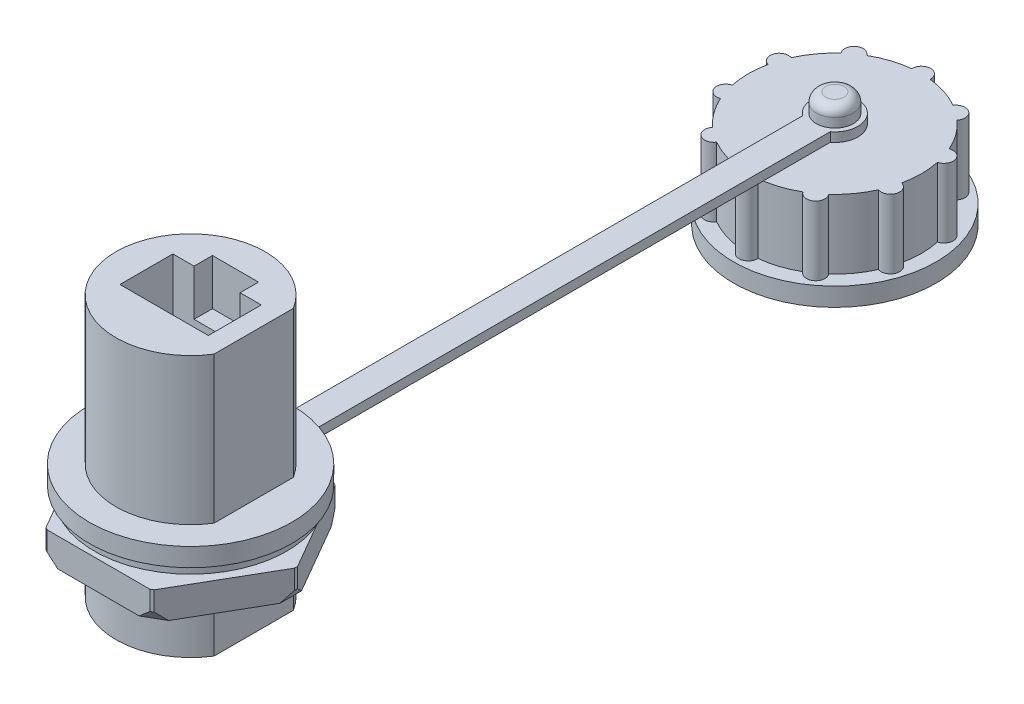
from build123d import *
from OCP.BRepFilletAPI import BRepFilletAPI_MakeChamfer

# Parameters (mm, degrees)
BOSS_EXTRUDE1_DEPTH  = 13.335
SKETCH2_R            = 13.97
BOSS_EXTRUDE2_DEPTH  = 2.54
BOSS_EXTRUDE3_DEPTH  = 36.068
BOSS_EXTRUDE4_START  = 6.477
SKETCH3_R            = 10.287
BOSS_EXTRUDE4_DEPTH  = 3.937
CHAMFER1_SIZE        = 0.254
CHAMFER1_EDGE_2_SIZE = 0.254
CHAMFER1_EDGE_3_SIZE = 0.254
CHAMFER1_EDGE_4_SIZE = 0.254
CHAMFER1_EDGE_5_SIZE = 0.254
CHAMFER1_EDGE_6_SIZE = 0.254
SKETCH4_W            = 12.192
SKETCH4_H            = 7.3025
CUT_EXTRUDE1_DEPTH   = 10.922
SKETCH5_W            = 6.35
SKETCH5_H            = 2.54
CUT_EXTRUDE2_DEPTH   = 6.35
SKETCH6_R            = 13.267076916
BOSS_EXTRUDE5_DEPTH  = 1.27
BOSS_EXTRUDE6_DEPTH  = 1.27
SKETCH8_R            = 2.54
BOSS_EXTRUDE7_DEPTH  = 2.54
FILLET1_R            = 1.27
SKETCH9_R            = 11.938
BOSS_EXTRUDE8_DEPTH  = 12.065
SKETCH10_R           = 13.97
BOSS_EXTRUDE9_DEPTH  = 2.54
SKETCH11_R           = 10.287
CUT_EXTRUDE3_DEPTH   = 6.223
SKETCH12_R           = 1.27
BOSS_EXTRUDE10_DEPTH = 9.525
CIRPATTERN1_COUNT    = 10
CHAMFER2_SIZE        = 1.27
CHAMFER2_SIZE2       = 0.733234842


with BuildPart() as part:
    # Sketch1 → Boss-Extrude1 (new body)
    with BuildSketch(Plane(origin=(0, 0, 0), x_dir=(1, 0, 0), z_dir=(0, 1, 0))):
        with BuildLine():
            Line((8.7122, -5.469912263), (8.7122, 5.469912263))
            ThreePointArc((8.7122, 5.469912263), (-10.287, 0), (8.7122, -5.469912263))
        make_face()
    extrude(amount=BOSS_EXTRUDE1_DEPTH)

    # Sketch2 → Boss-Extrude2 (add)
    with BuildSketch(Plane(origin=(0, 13.335, 0), x_dir=(1, 0, 0), z_dir=(0, 1, 0))):
        with Locations(Location((0, 0, 0), (0, 0, 270))):
            Circle(SKETCH2_R)
    extrude(amount=BOSS_EXTRUDE2_DEPTH)

    # Sketch1<2> → Boss-Extrude3 (add)
    with BuildSketch(Plane(origin=(0, 0, 0), x_dir=(1, 0, 0), z_dir=(0, 1, 0))):
        with BuildLine():
            Line((8.7122, -5.469912263), (8.7122, 5.469912263))
            ThreePointArc((8.7122, 5.469912263), (-10.287, 0), (8.7122, -5.469912263))
        make_face()
    extrude(amount=BOSS_EXTRUDE3_DEPTH)

    # Sketch3 → Boss-Extrude4 (add)
    with BuildSketch(Plane.XZ.offset(-13.335).offset(BOSS_EXTRUDE4_START)):
        Polygon((7.332348419, 12.7), (-7.332348419, 12.7), (-14.664696837, 0), (-7.332348419, -12.7), (7.332348419, -12.7), (14.664696837, 0), align=None)
        Circle(SKETCH3_R, mode=Mode.SUBTRACT)
    extrude(amount=-BOSS_EXTRUDE4_DEPTH)

    # Chamfer1
    chamfer1_edges = [part.edges().sort_by_distance(p)[0] for p in [
        (14.664696837, 8.8265, 0),
    ]]
    chamfer(chamfer1_edges, length=CHAMFER1_SIZE)

    # Chamfer1 edge 2
    chamfer1_edge_2_edges = [part.edges().sort_by_distance(p)[0] for p in [
        (7.332348419, 8.8265, 12.7),
    ]]
    chamfer(chamfer1_edge_2_edges, length=CHAMFER1_EDGE_2_SIZE)

    # Chamfer1 edge 3
    chamfer1_edge_3_edges = [part.edges().sort_by_distance(p)[0] for p in [
        (-7.332348419, 8.8265, 12.7),
    ]]
    chamfer(chamfer1_edge_3_edges, length=CHAMFER1_EDGE_3_SIZE)

    # Chamfer1 edge 4
    chamfer1_edge_4_edges = [part.edges().sort_by_distance(p)[0] for p in [
        (-14.664696837, 8.8265, 0),
    ]]
    chamfer(chamfer1_edge_4_edges, length=CHAMFER1_EDGE_4_SIZE)

    # Chamfer1 edge 5
    chamfer1_edge_5_edges = [part.edges().sort_by_distance(p)[0] for p in [
        (-7.332348419, 8.8265, -12.7),
    ]]
    chamfer(chamfer1_edge_5_edges, length=CHAMFER1_EDGE_5_SIZE)

    # Chamfer1 edge 6
    chamfer1_edge_6_edges = [part.edges().sort_by_distance(p)[0] for p in [
        (7.332348419, 8.8265, -12.7),
    ]]
    chamfer(chamfer1_edge_6_edges, length=CHAMFER1_EDGE_6_SIZE)

    # Sketch4 → Cut-Extrude1 (cut)
    with BuildSketch(Plane.XZ):
        Rectangle(SKETCH4_W, SKETCH4_H)
    cut_extrude1 = extrude(amount=-CUT_EXTRUDE1_DEPTH, mode=Mode.SUBTRACT)

    # Sketch5 → Cut-Extrude2 (cut)
    with BuildSketch(Plane.XZ):
        with Locations((0, -4.92125)):
            Rectangle(SKETCH5_W, SKETCH5_H)
    cut_extrude2 = extrude(amount=-CUT_EXTRUDE2_DEPTH, mode=Mode.SUBTRACT)

    # Mirror1: Cut-Extrude1, Cut-Extrude2 across plane
    add(cut_extrude1.mirror(Plane(origin=(0, 18.034, 0), x_dir=(0, 0, 1), z_dir=(0, -1, 0))), mode=Mode.SUBTRACT)
    add(cut_extrude2.mirror(Plane(origin=(0, 18.034, 0), x_dir=(0, 0, 1), z_dir=(0, -1, 0))), mode=Mode.SUBTRACT)

    # Sketch6 → Boss-Extrude5 (add)
    with BuildSketch(Plane.XZ.offset(-13.335)):
        with Locations(Location((0, 0, 0), (0, 0, 90))):
            Circle(SKETCH6_R)
    extrude(amount=BOSS_EXTRUDE5_DEPTH)

    # Sketch7 → Boss-Extrude6 (add)
    with BuildSketch(Plane.XZ.offset(-12.065)):
        with BuildLine():
            Line((-1.905, -10.109072361), (1.905, -10.109072361))
            Line((1.905, -10.109072361), (1.905, -86.309072361))
            ThreePointArc((1.905, -86.309072361), (0, -92.024072361), (-1.905, -86.309072361))
            Line((-1.905, -86.309072361), (-1.905, -10.109072361))
        make_face()
    extrude(amount=-BOSS_EXTRUDE6_DEPTH)

    # Sketch8 → Boss-Extrude7 (add)
    with BuildSketch(Plane(origin=(0, 13.335, 0), x_dir=(1, 0, 0), z_dir=(0, 1, 0))):
        with Locations(Location((0, 88.849072361, 0), (0, 0, 270))):
            Circle(SKETCH8_R)
    extrude(amount=BOSS_EXTRUDE7_DEPTH)

    # Fillet1
    fillet1_edges = [part.edges().sort_by_distance(p)[0] for p in [
        (0, 15.875, -91.389072361),
    ]]
    fillet(fillet1_edges, radius=FILLET1_R)

    # Sketch9 → Boss-Extrude8 (add)
    with BuildSketch(Plane.XZ.offset(-12.065)):
        with Locations(Location((0, -88.849072361, 0), (0, 0, 99.182197699))):
            Circle(SKETCH9_R)
    extrude(amount=BOSS_EXTRUDE8_DEPTH)

    # Sketch10 → Boss-Extrude9 (add)
    with BuildSketch(Plane.XZ):
        with Locations(Location((0, -88.849072361, 0), (0, 0, 270))):
            Circle(SKETCH10_R)
    extrude(amount=-BOSS_EXTRUDE9_DEPTH)

    # Sketch11 → Cut-Extrude3 (cut)
    with BuildSketch(Plane.XZ):
        with Locations(Location((0, -88.849072361, 0), (0, 0, 270))):
            Circle(SKETCH11_R)
    extrude(amount=-CUT_EXTRUDE3_DEPTH, mode=Mode.SUBTRACT)

    # Sketch12 → Boss-Extrude10 (add)
    with BuildSketch(Plane(origin=(0, 12.065, 0), x_dir=(1, 0, 0), z_dir=(0, 1, 0))):
        with Locations((0, 100.787072361)):
            Circle(SKETCH12_R)
    boss_extrude10 = extrude(amount=-BOSS_EXTRUDE10_DEPTH)

    # CirPattern1: Boss-Extrude10 ×10 about axis
    cirpattern1_axis = Axis((0, 0, -88.849072361), (0, 1, 0))
    for i in range(1, CIRPATTERN1_COUNT):
        add(boss_extrude10.rotate(cirpattern1_axis, i * 360 / CIRPATTERN1_COUNT))

    # Chamfer2: one chamfer whose edges measure the first distance from different faces: ONE call of the kernel's chamfer builder (chamfer() names one face for all edges)
    chamfer2_edges_1 = [part.edges().sort_by_distance(p)[0] for p in [
        (7.268848419, 6.858, -12.590014774),
    ]]
    chamfer2_side_1 = [part.faces().sort_by_distance(p)[0] for p in [
        (7.268848419, 8.8265, -12.590014774),
    ]]
    chamfer2_edges_2 = [part.edges().sort_by_distance(p)[0] for p in [
        (-7.268848419, 6.858, -12.590014774),
    ]]
    chamfer2_side_2 = [part.faces().sort_by_distance(p)[0] for p in [
        (-7.268848419, 8.8265, -12.590014774),
    ]]
    chamfer2_edges_3 = [part.edges().sort_by_distance(p)[0] for p in [
        (-14.537696837, 6.858, 0),
    ]]
    chamfer2_side_3 = [part.faces().sort_by_distance(p)[0] for p in [
        (-14.537696837, 8.8265, 0),
    ]]
    chamfer2_edges_4 = [part.edges().sort_by_distance(p)[0] for p in [
        (-7.268848419, 6.858, 12.590014774),
    ]]
    chamfer2_side_4 = [part.faces().sort_by_distance(p)[0] for p in [
        (-7.268848419, 8.8265, 12.590014774),
    ]]
    chamfer2_edges_5 = [part.edges().sort_by_distance(p)[0] for p in [
        (7.268848419, 6.858, 12.590014774),
    ]]
    chamfer2_side_5 = [part.faces().sort_by_distance(p)[0] for p in [
        (7.268848419, 8.8265, 12.590014774),
    ]]
    chamfer2_edges_6 = [part.edges().sort_by_distance(p)[0] for p in [
        (14.537696837, 6.858, 0),
    ]]
    chamfer2_side_6 = [part.faces().sort_by_distance(p)[0] for p in [
        (14.537696837, 8.8265, 0),
    ]]
    chamfer2 = BRepFilletAPI_MakeChamfer(part.part.solid().wrapped)
    for e in chamfer2_edges_1:
        chamfer2.Add(CHAMFER2_SIZE, CHAMFER2_SIZE2, e.wrapped, chamfer2_side_1[0].wrapped)  # the first distance lies on this face
    for e in chamfer2_edges_2:
        chamfer2.Add(CHAMFER2_SIZE, CHAMFER2_SIZE2, e.wrapped, chamfer2_side_2[0].wrapped)  # the first distance lies on this face
    for e in chamfer2_edges_3:
        chamfer2.Add(CHAMFER2_SIZE, CHAMFER2_SIZE2, e.wrapped, chamfer2_side_3[0].wrapped)  # the first distance lies on this face
    for e in chamfer2_edges_4:
        chamfer2.Add(CHAMFER2_SIZE, CHAMFER2_SIZE2, e.wrapped, chamfer2_side_4[0].wrapped)  # the first distance lies on this face
    for e in chamfer2_edges_5:
        chamfer2.Add(CHAMFER2_SIZE, CHAMFER2_SIZE2, e.wrapped, chamfer2_side_5[0].wrapped)  # the first distance lies on this face
    for e in chamfer2_edges_6:
        chamfer2.Add(CHAMFER2_SIZE, CHAMFER2_SIZE2, e.wrapped, chamfer2_side_6[0].wrapped)  # the first distance lies on this face
    add(Compound.cast(chamfer2.Shape()), mode=Mode.REPLACE)


solid = part.part
